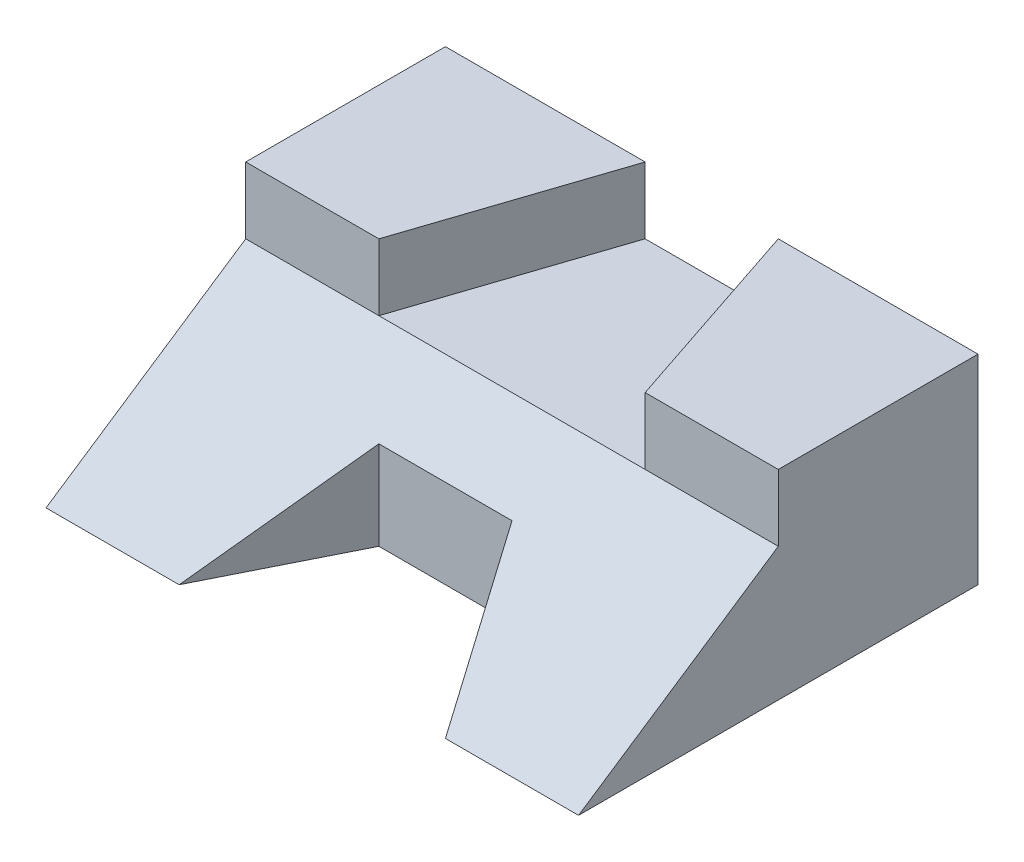
from build123d import *

# Parameters (mm, degrees)
BOSS_EXTRUDE1_DEPTH = 80
CUT_EXTRUDE1_DEPTH  = 10
CUT_EXTRUDE2_REACH  = 106.403


with BuildPart() as part:
    # Sketch2 → Boss-Extrude1 (new body)
    with BuildSketch(Plane(origin=(0, 0, 0), x_dir=(0, 0, -1), z_dir=(1, 0, 0))):
        Polygon((0, 0), (0, 30), (-30, 30), (-30, 20), (-60, 0), align=None)
    extrude(amount=BOSS_EXTRUDE1_DEPTH)

    # Sketch3 → Cut-Extrude1 (cut)
    with BuildSketch(Plane(origin=(0, 30, 0), x_dir=(1, 0, 0), z_dir=(0, 1, 0))):
        Polygon((50, 0), (30, 0), (20, -30), (60, -30), align=None)
    extrude(amount=-CUT_EXTRUDE1_DEPTH, mode=Mode.SUBTRACT)

    # Sketch4 → Cut-Extrude2 (cut, up to next)
    with BuildSketch(Plane.XZ, mode=Mode.PRIVATE) as cut_extrude2_sk1:
        Polygon((60, 60), (20, 60), (30, 40), (50, 40), align=None)
    cut_extrude2_tool1 = extrude(cut_extrude2_sk1.sketch, amount=-CUT_EXTRUDE2_REACH, mode=Mode.PRIVATE) & part.part
    add(cut_extrude2_tool1.solids().sort_by_distance((40, 0, 51.111111))[0], mode=Mode.SUBTRACT)


solid = part.part
